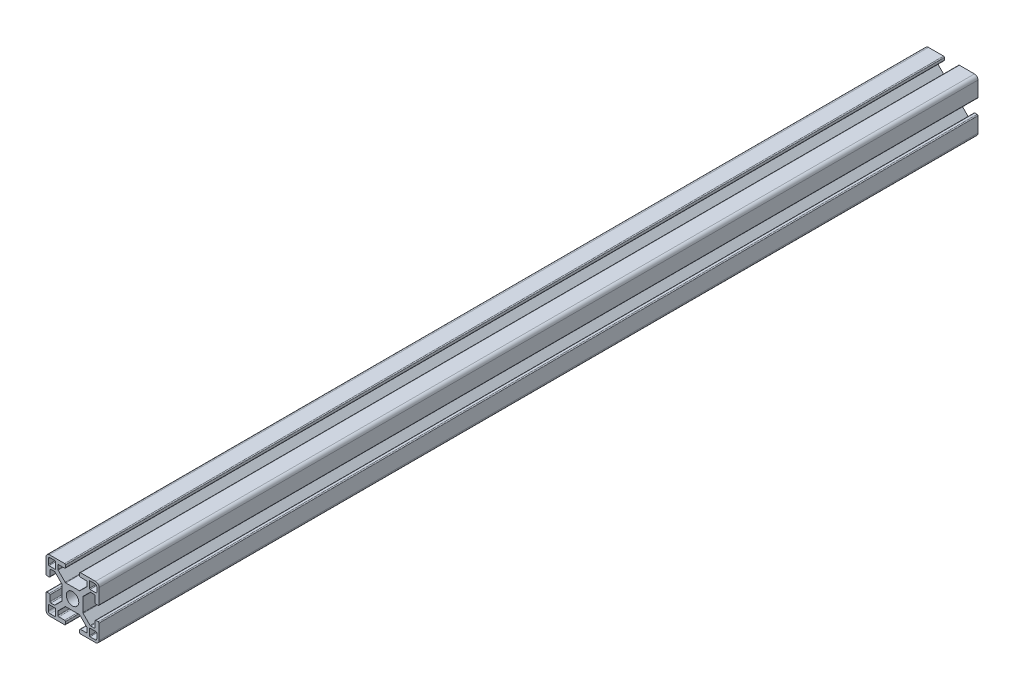
from build123d import *

# Parameters (mm, degrees)
SKETCH1_R           = 3.52998588
BOSS_EXTRUDE1_DEPTH = 248.45


with BuildPart() as part:
    # Sketch1 → Boss-Extrude1 (new, symmetric)
    with BuildSketch(Plane.XY):
        with BuildLine():
            Line((14.49994, -4), (13.24247465, -4))
            ThreePointArc((13.24247465, -4), (12.88892126, -4.146446609), (12.74247465, -4.5))
            Line((12.74247465, -4.5), (12.74247465, -7.732519321))
            ThreePointArc((12.74247465, -7.732519321), (12.602449697, -8.097296796), (12.242781236, -8.249967))
            Line((12.242781236, -8.249967), (10.260188032, -8.249967))
            ThreePointArc((10.260188032, -8.249967), (10.068847082, -8.211906919), (9.906636056, -8.103520976))
            Line((9.906636056, -8.103520976), (5.981117769, -4.178002689))
            ThreePointArc((5.981117769, -4.178002689), (5.872731827, -4.015791664), (5.834671745, -3.824450713))
            Line((5.834671745, -3.824450713), (5.834671745, -1.01249595))
            Line((5.834671745, -1.01249595), (5.834671745, 0.88749645))
            Line((5.834671745, 0.88749645), (5.834671745, 3.824450713))
            ThreePointArc((5.834671745, 3.824450713), (5.872731827, 4.015791664), (5.981117769, 4.178002689))
            Line((5.981117769, 4.178002689), (9.906636056, 8.103520976))
            ThreePointArc((9.906636056, 8.103520976), (10.068847082, 8.211906919), (10.260188032, 8.249967))
            Line((10.260188032, 8.249967), (12.242781236, 8.249967))
            ThreePointArc((12.242781236, 8.249967), (12.602449697, 8.097296796), (12.74247465, 7.732519321))
            Line((12.74247465, 7.732519321), (12.74247465, 4.5))
            ThreePointArc((12.74247465, 4.5), (12.88892126, 4.146446609), (13.24247465, 4))
            Line((13.24247465, 4), (14.49994, 4))
            ThreePointArc((14.49994, 4), (14.853493391, 4.146446609), (14.99994, 4.5))
            Line((14.99994, 4.5), (14.99994, 12.999948))
            ThreePointArc((14.99994, 12.999948), (14.414155906, 14.414155906), (12.999948, 14.99994))
            Line((12.999948, 14.99994), (4.5, 14.99994))
            ThreePointArc((4.5, 14.99994), (4.146446609, 14.853493391), (4, 14.49994))
            Line((4, 14.49994), (4, 13.24247465))
            ThreePointArc((4, 13.24247465), (4.146446609, 12.88892126), (4.5, 12.74247465))
            Line((4.5, 12.74247465), (7.732519321, 12.74247465))
            ThreePointArc((7.732519321, 12.74247465), (8.097296796, 12.602449697), (8.249967, 12.242781236))
            Line((8.249967, 12.242781236), (8.249967, 10.260188032))
            ThreePointArc((8.249967, 10.260188032), (8.211906919, 10.068847082), (8.103520976, 9.906636056))
            Line((8.103520976, 9.906636056), (4.178002689, 5.981117769))
            ThreePointArc((4.178002689, 5.981117769), (4.015791664, 5.872731827), (3.824450713, 5.834671745))
            Line((3.824450713, 5.834671745), (0.9499962, 5.834671745))
            Line((0.9499962, 5.834671745), (-0.9499962, 5.834671745))
            Line((-0.9499962, 5.834671745), (-3.824450713, 5.834671745))
            ThreePointArc((-3.824450713, 5.834671745), (-4.015791664, 5.872731827), (-4.178002689, 5.981117769))
            Line((-4.178002689, 5.981117769), (-8.103520976, 9.906636056))
            ThreePointArc((-8.103520976, 9.906636056), (-8.211906919, 10.068847082), (-8.249967, 10.260188032))
            Line((-8.249967, 10.260188032), (-8.249967, 12.242781236))
            ThreePointArc((-8.249967, 12.242781236), (-8.097296796, 12.602449697), (-7.732519321, 12.74247465))
            Line((-7.732519321, 12.74247465), (-4.5, 12.74247465))
            ThreePointArc((-4.5, 12.74247465), (-4.146446609, 12.88892126), (-4, 13.24247465))
            Line((-4, 13.24247465), (-4, 14.49994))
            ThreePointArc((-4, 14.49994), (-4.146446609, 14.853493391), (-4.5, 14.99994))
            Line((-4.5, 14.99994), (-12.999948, 14.99994))
            ThreePointArc((-12.999948, 14.99994), (-14.414155906, 14.414155906), (-14.99994, 12.999948))
            Line((-14.99994, 12.999948), (-14.99994, 4.5))
            ThreePointArc((-14.99994, 4.5), (-14.853493391, 4.146446609), (-14.49994, 4))
            Line((-14.49994, 4), (-13.24247465, 4))
            ThreePointArc((-13.24247465, 4), (-12.88892126, 4.146446609), (-12.74247465, 4.5))
            Line((-12.74247465, 4.5), (-12.74247465, 7.732519321))
            ThreePointArc((-12.74247465, 7.732519321), (-12.602449697, 8.097296796), (-12.242781236, 8.249967))
            Line((-12.242781236, 8.249967), (-10.260188032, 8.249967))
            ThreePointArc((-10.260188032, 8.249967), (-10.068847082, 8.211906919), (-9.906636056, 8.103520976))
            Line((-9.906636056, 8.103520976), (-5.981117769, 4.178002689))
            ThreePointArc((-5.981117769, 4.178002689), (-5.872731827, 4.015791664), (-5.834671745, 3.824450713))
            Line((-5.834671745, 3.824450713), (-5.834671745, 0.88749645))
            Line((-5.834671745, 0.88749645), (-5.834671745, -1.01249595))
            Line((-5.834671745, -1.01249595), (-5.834671745, -3.824450713))
            ThreePointArc((-5.834671745, -3.824450713), (-5.872731827, -4.015791664), (-5.981117769, -4.178002689))
            Line((-5.981117769, -4.178002689), (-9.906636056, -8.103520976))
            ThreePointArc((-9.906636056, -8.103520976), (-10.068847082, -8.211906919), (-10.260188032, -8.249967))
            Line((-10.260188032, -8.249967), (-12.242781236, -8.249967))
            ThreePointArc((-12.242781236, -8.249967), (-12.602449697, -8.097296796), (-12.74247465, -7.732519321))
            Line((-12.74247465, -7.732519321), (-12.74247465, -4.5))
            ThreePointArc((-12.74247465, -4.5), (-12.88892126, -4.146446609), (-13.24247465, -4))
            Line((-13.24247465, -4), (-14.49994, -4))
            ThreePointArc((-14.49994, -4), (-14.853493391, -4.146446609), (-14.99994, -4.5))
            Line((-14.99994, -4.5), (-14.99994, -12.999948))
            ThreePointArc((-14.99994, -12.999948), (-14.414155906, -14.414155906), (-12.999948, -14.99994))
            Line((-12.999948, -14.99994), (-4.5, -14.99994))
            ThreePointArc((-4.5, -14.99994), (-4.146446609, -14.853493391), (-4, -14.49994))
            Line((-4, -14.49994), (-4, -13.24247465))
            ThreePointArc((-4, -13.24247465), (-4.146446609, -12.88892126), (-4.5, -12.74247465))
            Line((-4.5, -12.74247465), (-7.732519321, -12.74247465))
            ThreePointArc((-7.732519321, -12.74247465), (-8.097296796, -12.602449697), (-8.249967, -12.242781236))
            Line((-8.249967, -12.242781236), (-8.249967, -10.260188032))
            ThreePointArc((-8.249967, -10.260188032), (-8.211906919, -10.068847082), (-8.103520976, -9.906636056))
            Line((-8.103520976, -9.906636056), (-4.178002689, -5.981117769))
            ThreePointArc((-4.178002689, -5.981117769), (-4.015791664, -5.872731827), (-3.824450713, -5.834671745))
            Line((-3.824450713, -5.834671745), (-0.9499962, -5.834671745))
            Line((-0.9499962, -5.834671745), (0.9499962, -5.834671745))
            Line((0.9499962, -5.834671745), (3.824450713, -5.834671745))
            ThreePointArc((3.824450713, -5.834671745), (4.015791664, -5.872731827), (4.178002689, -5.981117769))
            Line((4.178002689, -5.981117769), (8.103520976, -9.906636056))
            ThreePointArc((8.103520976, -9.906636056), (8.211906919, -10.068847082), (8.249967, -10.260188032))
            Line((8.249967, -10.260188032), (8.249967, -12.242781236))
            ThreePointArc((8.249967, -12.242781236), (8.097296796, -12.602449697), (7.732519321, -12.74247465))
            Line((7.732519321, -12.74247465), (4.5, -12.74247465))
            ThreePointArc((4.5, -12.74247465), (4.146446609, -12.88892126), (4, -13.24247465))
            Line((4, -13.24247465), (4, -14.49994))
            ThreePointArc((4, -14.49994), (4.146446609, -14.853493391), (4.5, -14.99994))
            Line((4.5, -14.99994), (12.999948, -14.99994))
            ThreePointArc((12.999948, -14.99994), (14.414155906, -14.414155906), (14.99994, -12.999948))
            Line((14.99994, -12.999948), (14.99994, -4.5))
            ThreePointArc((14.99994, -4.5), (14.853493391, -4.146446609), (14.49994, -4))
        make_face()
        Circle(SKETCH1_R, mode=Mode.SUBTRACT)
        with BuildLine():
            Line((-12.6999492, -13.6999452), (-9.880960476, -13.6999452))
            ThreePointArc((-9.880960476, -13.6999452), (-9.61155387, -13.58835333), (-9.499962, -13.318946724))
            Line((-9.499962, -13.318946724), (-9.499962, -9.87996048))
            ThreePointArc((-9.499962, -9.87996048), (-9.611260978, -9.611260978), (-9.87996048, -9.499962))
            Line((-9.87996048, -9.499962), (-13.318946724, -9.499962))
            ThreePointArc((-13.318946724, -9.499962), (-13.58835333, -9.61155387), (-13.6999452, -9.880960476))
            Line((-13.6999452, -9.880960476), (-13.6999452, -12.6999492))
            ThreePointArc((-13.6999452, -12.6999492), (-13.407053153, -13.407053153), (-12.6999492, -13.6999452))
        make_face(mode=Mode.SUBTRACT)
        with BuildLine():
            Line((13.6999452, -12.6999492), (13.6999452, -9.880960476))
            ThreePointArc((13.6999452, -9.880960476), (13.58835333, -9.61155387), (13.318946724, -9.499962))
            Line((13.318946724, -9.499962), (9.87996048, -9.499962))
            ThreePointArc((9.87996048, -9.499962), (9.611260978, -9.611260978), (9.499962, -9.87996048))
            Line((9.499962, -9.87996048), (9.499962, -13.318946724))
            ThreePointArc((9.499962, -13.318946724), (9.61155387, -13.58835333), (9.880960476, -13.6999452))
            Line((9.880960476, -13.6999452), (12.6999492, -13.6999452))
            ThreePointArc((12.6999492, -13.6999452), (13.407053153, -13.407053153), (13.6999452, -12.6999492))
        make_face(mode=Mode.SUBTRACT)
        with BuildLine():
            Line((9.87996048, 9.499962), (13.318946724, 9.499962))
            ThreePointArc((13.318946724, 9.499962), (13.58835333, 9.61155387), (13.6999452, 9.880960476))
            Line((13.6999452, 9.880960476), (13.6999452, 12.6999492))
            ThreePointArc((13.6999452, 12.6999492), (13.407053153, 13.407053153), (12.6999492, 13.6999452))
            Line((12.6999492, 13.6999452), (9.880960476, 13.6999452))
            ThreePointArc((9.880960476, 13.6999452), (9.61155387, 13.58835333), (9.499962, 13.318946724))
            Line((9.499962, 13.318946724), (9.499962, 9.87996048))
            ThreePointArc((9.499962, 9.87996048), (9.611260978, 9.611260978), (9.87996048, 9.499962))
        make_face(mode=Mode.SUBTRACT)
        with BuildLine():
            Line((-13.6999452, 12.6999492), (-13.6999452, 9.880960476))
            ThreePointArc((-13.6999452, 9.880960476), (-13.58835333, 9.61155387), (-13.318946724, 9.499962))
            Line((-13.318946724, 9.499962), (-9.87996048, 9.499962))
            ThreePointArc((-9.87996048, 9.499962), (-9.611260978, 9.611260978), (-9.499962, 9.87996048))
            Line((-9.499962, 9.87996048), (-9.499962, 13.318946724))
            ThreePointArc((-9.499962, 13.318946724), (-9.61155387, 13.58835333), (-9.880960476, 13.6999452))
            Line((-9.880960476, 13.6999452), (-12.6999492, 13.6999452))
            ThreePointArc((-12.6999492, 13.6999452), (-13.407053153, 13.407053153), (-13.6999452, 12.6999492))
        make_face(mode=Mode.SUBTRACT)
    extrude(amount=BOSS_EXTRUDE1_DEPTH, both=True)


solid = part.part
